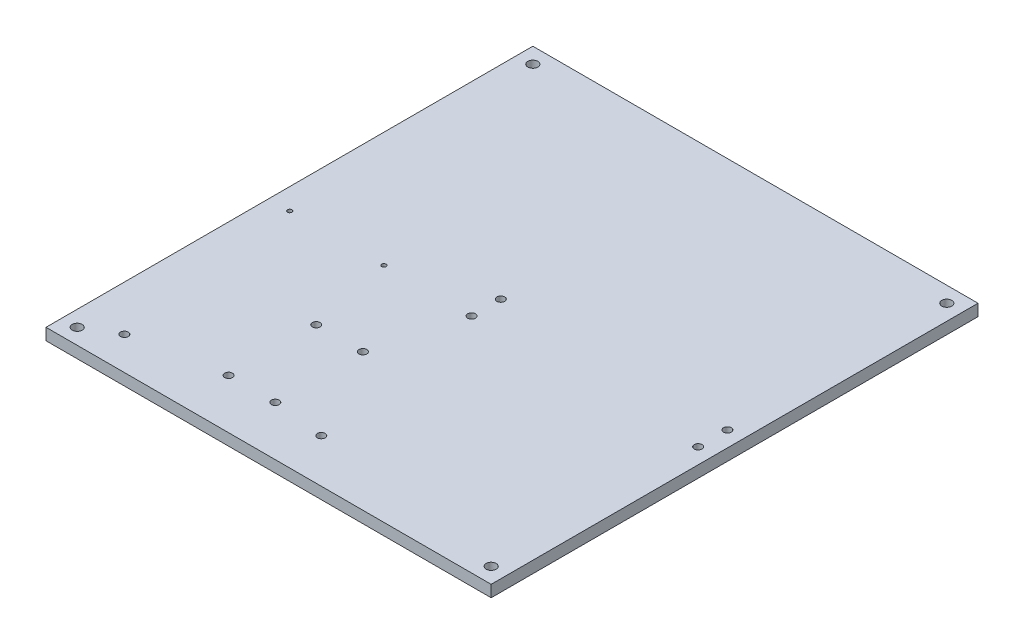
from build123d import *

# Parameters (mm, degrees)
SKETCH1_W                      = 228.6
SKETCH1_H                      = 250
PLATE_DEPTH                    = 3
SKETCH2_R                      = 2
MUX_BRACKET_HOLES_DEPTH        = 6
MUX_BRACKET_PATTERN_COUNT      = 2
MUX_BRACKET_PATTERN_PITCH      = 116.35
SKETCH3_R                      = 2
PUMP_STAND_HOLE_DEPTH          = 170.48595812
PUMP_STAND_PATTERN_COUNT       = 2
PUMP_STAND_PATTERN_PITCH       = 24
PUMP_STAND_PATTERN_COUNT_DIR2  = 2
PUMP_STAND_PATTERN_PITCH_DIR2  = 45
SKETCH4_R                      = 2
PUMP_INPUT_STAND_HOLE_DEPTH    = 170.48595812
SKETCH5_R                      = 2
CROSS_FITTING_STAND_HOLE_DEPTH = 170.48595812
SKETCH6_R                      = 2.58
STANDOFF_HOLES_DEPTH           = 170.48595812
SKETCH7_R                      = 1.1303
ARDUINO_HOLES_DEPTH            = 10


with BuildPart() as part:
    # Sketch1 → PLATE (new, symmetric)
    with BuildSketch(Plane(origin=(0, 0, 0), x_dir=(1, 0, 0), z_dir=(0, 1, 0))):
        Rectangle(SKETCH1_W, SKETCH1_H)
    extrude(amount=PLATE_DEPTH, both=True)

    # Sketch2 → MUX_BRACKET_HOLES (cut)
    with BuildSketch(Plane(origin=(0, 3, 0), x_dir=(1, 0, 0), z_dir=(0, 1, 0))):
        with Locations(Location((106.3, -10.7, 0), (0, 0, 270))):
            Circle(SKETCH2_R)
        with Locations(Location((106.3, 4.3, 0), (0, 0, 270))):
            Circle(SKETCH2_R)
    mux_bracket_holes = extrude(amount=-MUX_BRACKET_HOLES_DEPTH, mode=Mode.SUBTRACT)

    # MUX_BRACKET_PATTERN: MUX_BRACKET_HOLES ×2
    with Locations(*[(-i * MUX_BRACKET_PATTERN_PITCH, 0, 0) for i in range(1, MUX_BRACKET_PATTERN_COUNT)]):
        add(mux_bracket_holes, mode=Mode.SUBTRACT)

    # Sketch3 → PUMP_STAND_HOLE (cut, through all)
    with BuildSketch(Plane(origin=(0, 3, 0), x_dir=(1, 0, 0), z_dir=(0, 1, 0))):
        with Locations(Location((-22.05, -54.5, 0), (0, 0, 270))):
            Circle(SKETCH3_R)
    pump_stand_hole = extrude(amount=-PUMP_STAND_HOLE_DEPTH, mode=Mode.SUBTRACT)

    # PUMP_STAND_PATTERN: PUMP_STAND_HOLE 2 × 2
    with Locations(*[(-i * PUMP_STAND_PATTERN_PITCH, 0, j * PUMP_STAND_PATTERN_PITCH_DIR2) for i in range(PUMP_STAND_PATTERN_COUNT) for j in range(PUMP_STAND_PATTERN_COUNT_DIR2) if (i, j) != (0, 0)]):
        add(pump_stand_hole, mode=Mode.SUBTRACT)

    # Sketch4 → PUMP_INPUT_STAND_HOLE (cut, through all)
    with BuildSketch(Plane(origin=(0, 3, 0), x_dir=(1, 0, 0), z_dir=(0, 1, 0))):
        with Locations(Location((4.55, -102.5, 0), (0, 0, 270))):
            Circle(SKETCH4_R)
    extrude(amount=-PUMP_INPUT_STAND_HOLE_DEPTH, mode=Mode.SUBTRACT)

    # Sketch5 → CROSS_FITTING_STAND_HOLE (cut, through all)
    with BuildSketch(Plane(origin=(0, 3, 0), x_dir=(1, 0, 0), z_dir=(0, 1, 0))):
        with Locations(Location((-91.05, -108, 0), (0, 0, 270))):
            Circle(SKETCH5_R)
    extrude(amount=-CROSS_FITTING_STAND_HOLE_DEPTH, mode=Mode.SUBTRACT)

    # Sketch6 → STANDOFF_HOLES (cut, through all)
    with BuildSketch(Plane(origin=(0, 3, 0), x_dir=(1, 0, 0), z_dir=(0, 1, 0))):
        with Locations(Location((-106.3, -117, 0), (0, 0, 270))):
            Circle(SKETCH6_R)
        with Locations(Location((106.3, -117, 0), (0, 0, 270))):
            Circle(SKETCH6_R)
        with Locations(Location((106.3, 117, 0), (0, 0, 270))):
            Circle(SKETCH6_R)
        with Locations(Location((-106.3, 117, 0), (0, 0, 270))):
            Circle(SKETCH6_R)
    extrude(amount=-STANDOFF_HOLES_DEPTH, mode=Mode.SUBTRACT)

    # Sketch7 → ARDUINO_HOLES (cut)
    with BuildSketch(Plane(origin=(0, 3, 0), x_dir=(1, 0, 0), z_dir=(0, 1, 0))):
        with Locations(Location((-103.45, -10.7, 0), (0, 0, 270))):
            Circle(SKETCH7_R)
        with Locations(Location((-55.05, -10.7, 0), (0, 0, 270))):
            Circle(SKETCH7_R)
    extrude(amount=-ARDUINO_HOLES_DEPTH, mode=Mode.SUBTRACT)


solid = part.part
